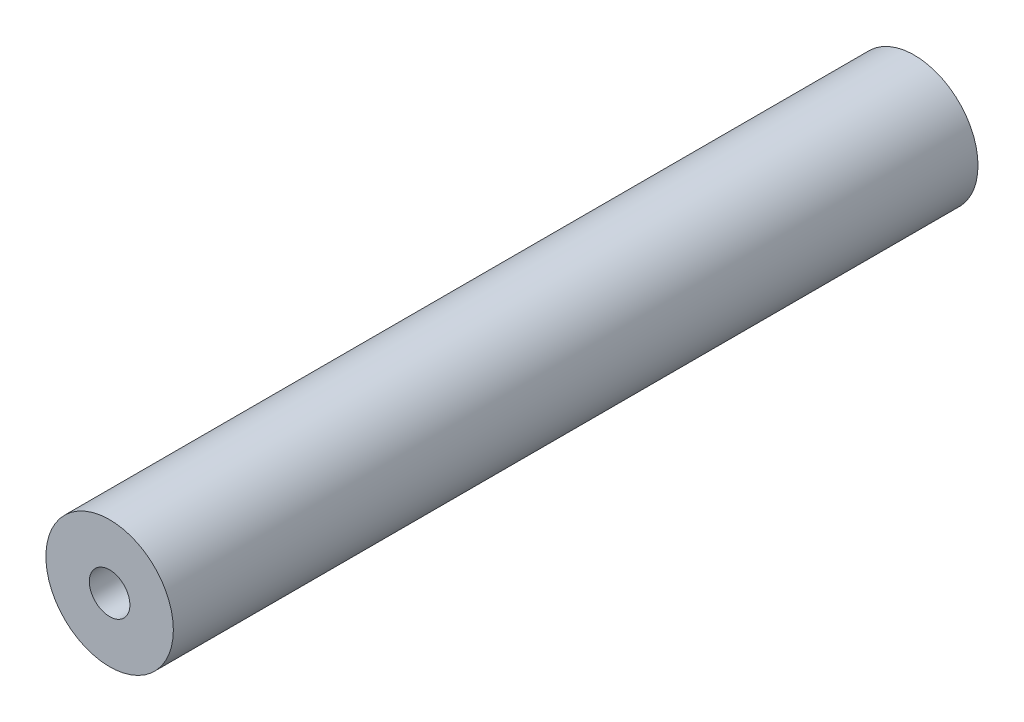
from build123d import *

# Parameters (mm, degrees)
SKETCH1_R                            = 6.35
BOSS_EXTRUDE1_DEPTH                  = 40.08501
F_10_32_TAPPED_HOLE1_D               = 4.0386
F_10_32_TAPPED_HOLE1_DEPTH           = 12.02944
F_10_32_TAPPED_HOLE1_TIP             = 1.213317848
F_10_32_TAPPED_HOLE1_ON_FACE_2_D     = 4.0386
F_10_32_TAPPED_HOLE1_ON_FACE_2_DEPTH = 12.02944
F_10_32_TAPPED_HOLE1_ON_FACE_2_TIP   = 1.213317848


with BuildPart() as part:
    # Sketch1 → Boss-Extrude1 (new, symmetric)
    with BuildSketch(Plane.XY):
        Circle(SKETCH1_R)
    extrude(amount=BOSS_EXTRUDE1_DEPTH, both=True)

    # #10-32 Tapped Hole1
    with Locations(Plane(origin=(0, 0, -40.08501), x_dir=(-1, 0, 0), z_dir=(0, 0, -1))):
        with Locations((0, 0)):
            Hole(F_10_32_TAPPED_HOLE1_D / 2, depth=F_10_32_TAPPED_HOLE1_DEPTH)
            with Locations((0, 0, -(F_10_32_TAPPED_HOLE1_DEPTH + F_10_32_TAPPED_HOLE1_TIP / 2))):  # 118° drill point
                Cone(0, F_10_32_TAPPED_HOLE1_D / 2, F_10_32_TAPPED_HOLE1_TIP, mode=Mode.SUBTRACT)

    # #10-32 Tapped Hole1 on face 2
    with Locations(Plane.XY.offset(40.08501)):
        with Locations((0, 0)):
            Hole(F_10_32_TAPPED_HOLE1_ON_FACE_2_D / 2, depth=F_10_32_TAPPED_HOLE1_ON_FACE_2_DEPTH)
            with Locations((0, 0, -(F_10_32_TAPPED_HOLE1_ON_FACE_2_DEPTH + F_10_32_TAPPED_HOLE1_ON_FACE_2_TIP / 2))):  # 118° drill point
                Cone(0, F_10_32_TAPPED_HOLE1_ON_FACE_2_D / 2, F_10_32_TAPPED_HOLE1_ON_FACE_2_TIP, mode=Mode.SUBTRACT)


solid = part.part
